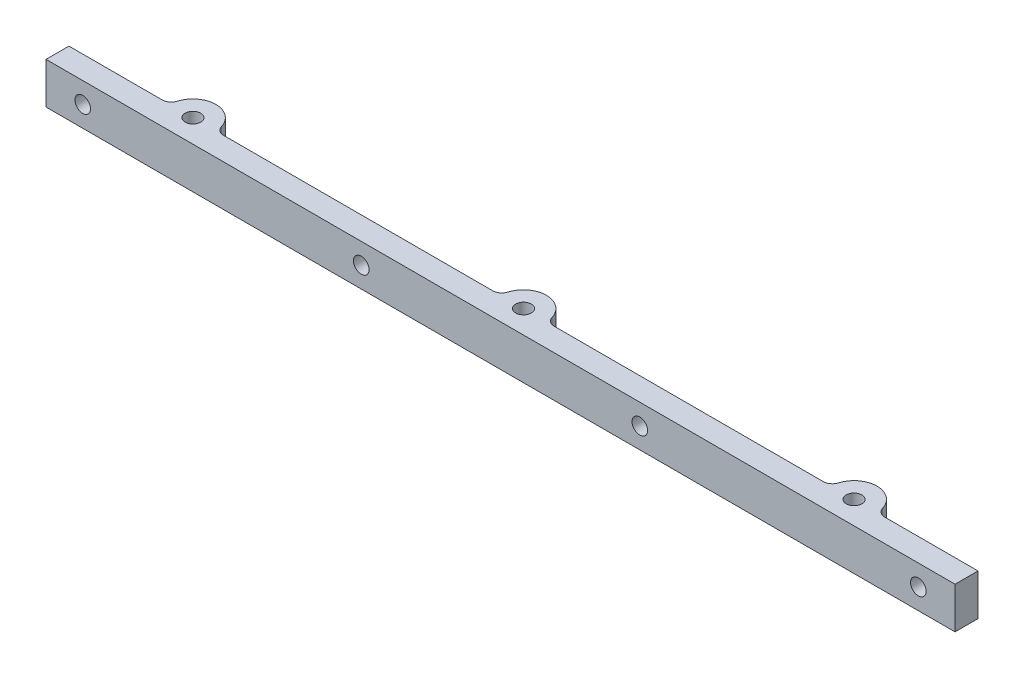
from build123d import *

# Parameters (mm, degrees)
BOSS_EXTRU_1_DEPTH      = 9
D_GAGEMENT_M31_D        = 3.4
ENL_V_MAT_EXTRU_1_DEPTH = 2.5
D_GAGEMENT_M32_D        = 3.4
ENL_V_MAT_EXTRU_2_DEPTH = 2.5
CONG_1_R                = 2


with BuildPart() as part:
    # Esquisse1 → Boss.-Extru.1 (new body)
    with BuildSketch(Plane(origin=(0, 0, 0), x_dir=(1, 0, 0), z_dir=(0, 1, 0))):
        with BuildLine():
            Line((-99, 2.5), (-77, 2.5))
            ThreePointArc((-77, 2.5), (-72, 7.5), (-67, 2.5))
            Line((-67, 2.5), (-5, 2.5))
            ThreePointArc((-5, 2.5), (0, 7.5), (5, 2.5))
            Line((5, 2.5), (67, 2.5))
            ThreePointArc((67, 2.5), (72, 7.5), (77, 2.5))
            Line((77, 2.5), (99, 2.5))
            Line((99, 2.5), (99, -2.5))
            Line((99, -2.5), (-99, -2.5))
            Line((-99, -2.5), (-99, 2.5))
        make_face()
    extrude(amount=BOSS_EXTRU_1_DEPTH)

    # Dégagement M31 (through all)
    with Locations(Plane(origin=(0, 9, 0), x_dir=(1, 0, 0), z_dir=(0, 1, 0))):
        with Locations((-72, 2.5), (0, 2.5), (72, 2.5)):
            Hole(D_GAGEMENT_M31_D / 2)

    # Esquisse5 → Enlèv. mat.-Extru.1 (cut)
    with BuildSketch(Plane.XZ):
        Polygon((70.41228676, -5.25), (73.58771324, -5.25), (75.175426481, -2.5), (73.58771324, 0.25), (70.41228676, 0.25), (68.824573519, -2.5), align=None)
        Polygon((-1.58771324, -5.25), (1.58771324, -5.25), (3.175426481, -2.5), (1.58771324, 0.25), (-1.58771324, 0.25), (-3.175426481, -2.5), align=None)
        Polygon((-73.58771324, -5.25), (-70.41228676, -5.25), (-68.824573519, -2.5), (-70.41228676, 0.25), (-73.58771324, 0.25), (-75.175426481, -2.5), align=None)
    extrude(amount=-ENL_V_MAT_EXTRU_1_DEPTH, mode=Mode.SUBTRACT)

    # Dégagement M32 (through all)
    with Locations(Plane.XY.offset(2.5)):
        with Locations((-91, 4.5), (-30.333333333, 4.5), (30.333333333, 4.5), (91, 4.5)):
            Hole(D_GAGEMENT_M32_D / 2)

    # Esquisse9 → Enlèv. mat.-Extru.2 (cut)
    with BuildSketch(Plane(origin=(0, 0, -2.5), x_dir=(-1, 0, 0), z_dir=(0, 0, -1))):
        Polygon((-89.41228676, 7.25), (-92.58771324, 7.25), (-94.175426481, 4.5), (-92.58771324, 1.75), (-89.41228676, 1.75), (-87.824573519, 4.5), align=None)
        Polygon((-28.745620093, 7.25), (-31.921046574, 7.25), (-33.508759814, 4.5), (-31.921046574, 1.75), (-28.745620093, 1.75), (-27.157906853, 4.5), align=None)
        Polygon((31.921046574, 7.25), (28.745620093, 7.25), (27.157906853, 4.5), (28.745620093, 1.75), (31.921046574, 1.75), (33.508759814, 4.5), align=None)
        Polygon((92.58771324, 7.25), (89.41228676, 7.25), (87.824573519, 4.5), (89.41228676, 1.75), (92.58771324, 1.75), (94.175426481, 4.5), align=None)
    extrude(amount=-ENL_V_MAT_EXTRU_2_DEPTH, mode=Mode.SUBTRACT)

    # Congé1
    cong_1_edges = [part.edges().sort_by_distance(p)[0] for p in [
        (-77, 4.5, -2.5),
        (-67, 4.5, -2.5),
        (-5, 4.5, -2.5),
        (5, 4.5, -2.5),
        (67, 4.5, -2.5),
        (77, 4.5, -2.5),
    ]]
    fillet(cong_1_edges, radius=CONG_1_R)


solid = part.part
